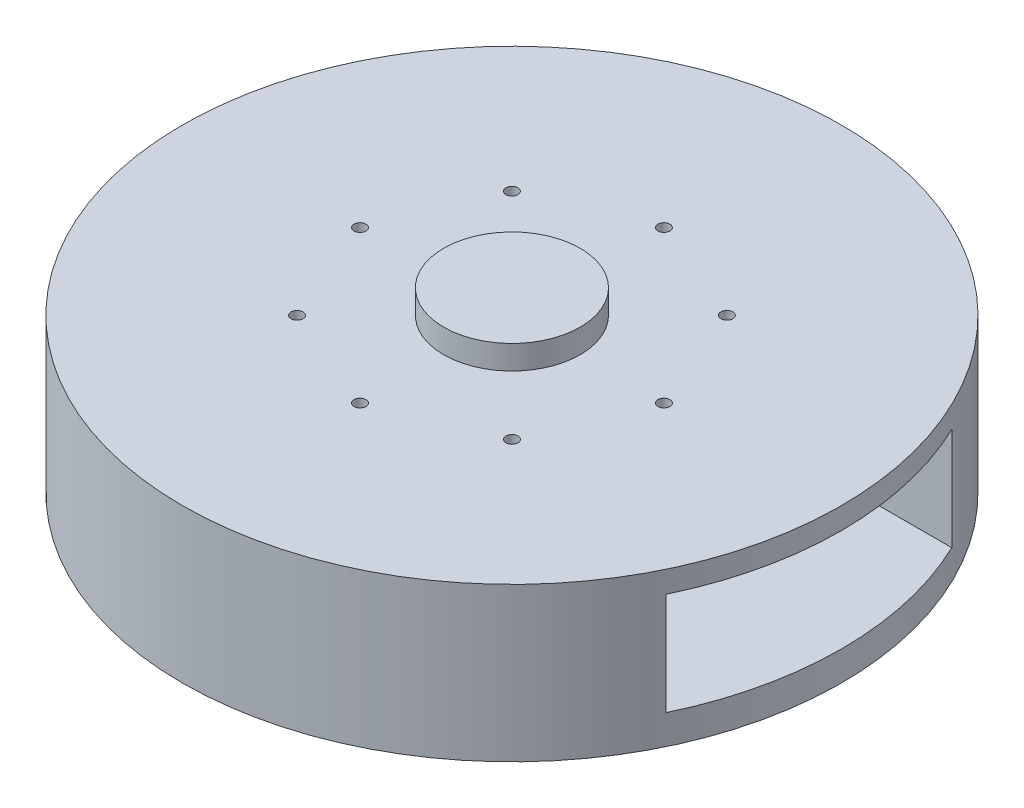
from build123d import *

# Parameters (mm, degrees)
SKETCH_1_R          = 96.5
EXTRUDE_1_DEPTH     = 45
SKETCH_2_R          = 48.25
CUT_EXTRUDE_1_DEPTH = 42.3
SKETCH_3_W          = 83.620488478
SKETCH_3_H          = 30
CUT_EXTRUDE_2_DEPTH = 500
SKETCH_5_R          = 20
EXTRUDE_2_DEPTH     = 7
SKETCH_8_R          = 1.75
CUT_EXTRUDE_3_DEPTH = 143.876835071


with BuildPart() as part:
    # 草图1 → 凸台-拉伸1 (new body)
    with BuildSketch(Plane(origin=(0, 0, 0), x_dir=(1, 0, 0), z_dir=(0, 1, 0))):
        with Locations(Location((0, 0, 0), (0, 0, 90))):
            Circle(SKETCH_1_R)
    extrude(amount=EXTRUDE_1_DEPTH)

    # 草图2 → 切除-拉伸1 (cut)
    with BuildSketch(Plane(origin=(0, 0, 0), x_dir=(-1, 0, 0), z_dir=(0, -1, 0))):
        with Locations(Location((0, 0, 0), (0, 0, 90))):
            Circle(SKETCH_2_R)
    extrude(amount=-CUT_EXTRUDE_1_DEPTH, mode=Mode.SUBTRACT)

    # 草图3 → 切除-拉伸2 (cut, symmetric)
    with BuildSketch(Plane(origin=(0, 0, 0), x_dir=(0, 0, -1), z_dir=(1, 0, 0))):
        with Locations((0, 23.651984039)):
            Rectangle(SKETCH_3_W, SKETCH_3_H)
    extrude(amount=CUT_EXTRUDE_2_DEPTH, both=True, mode=Mode.SUBTRACT)

    # 草图5 → 凸台-拉伸2 (add)
    with BuildSketch(Plane(origin=(0, 45, 0), x_dir=(1, 0, 0), z_dir=(0, 1, 0))):
        with Locations(Location((0, 0, 0), (0, 0, 270))):
            Circle(SKETCH_5_R)
    extrude(amount=EXTRUDE_2_DEPTH)

    # 草图8 → 切除-拉伸3 (cut, through all)
    with BuildSketch(Plane(origin=(0, 42.3, 0), x_dir=(-1, 0, 0), z_dir=(0, -1, 0))):
        with Locations(Location((0, -44.5, 0), (0, 0, 90))):
            Circle(SKETCH_8_R)
        with Locations(Location((-31.466251763, -31.466251763, 0), (0, 0, 90))):
            Circle(SKETCH_8_R)
        with Locations(Location((-44.5, 0, 0), (0, 0, 90))):
            Circle(SKETCH_8_R)
        with Locations(Location((-31.466251763, 31.466251763, 0), (0, 0, 90))):
            Circle(SKETCH_8_R)
        with Locations(Location((0, 44.5, 0), (0, 0, 90))):
            Circle(SKETCH_8_R)
        with Locations(Location((31.466251763, 31.466251763, 0), (0, 0, 90))):
            Circle(SKETCH_8_R)
        with Locations(Location((44.5, 0, 0), (0, 0, 90))):
            Circle(SKETCH_8_R)
        with Locations(Location((31.466251763, -31.466251763, 0), (0, 0, 90))):
            Circle(SKETCH_8_R)
    extrude(amount=-CUT_EXTRUDE_3_DEPTH, mode=Mode.SUBTRACT)


solid = part.part
